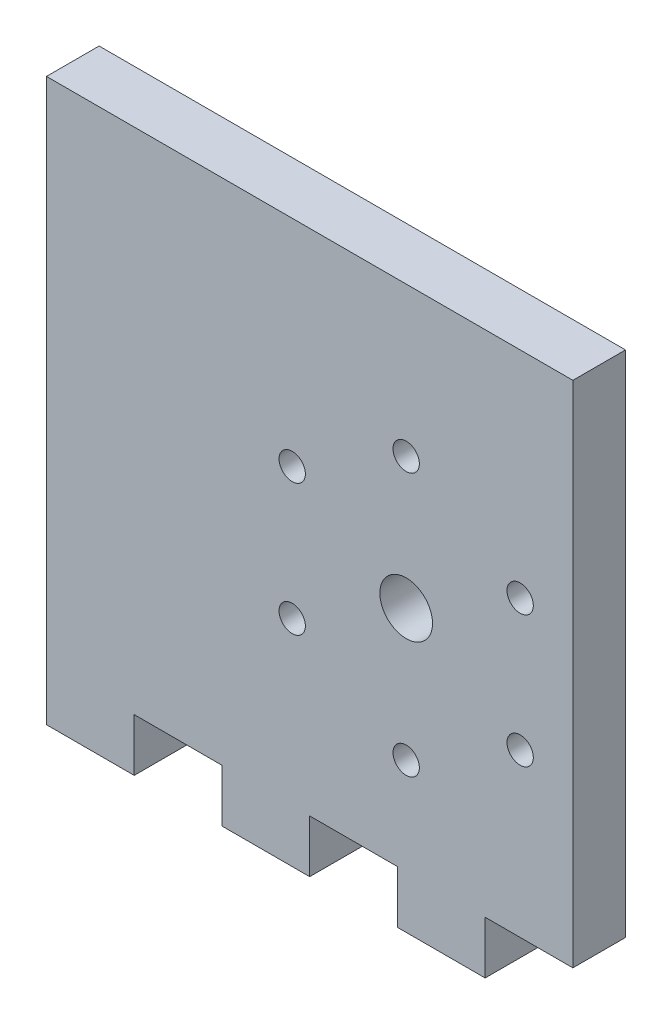
from build123d import *

# Parameters (mm, degrees)
SKETCH1_R               = 0.75
SKETCH1_R_2             = 1.5
BOSS_EXTRUDE1_DEPTH     = 3
CORTAR_EXTRUIR1_START   = -3
CROQUIS1_W              = 15
CROQUIS1_H              = 6.71890751
CORTAR_EXTRUIR1_DEPTH   = 3
CROQUIS2_W              = 30
CROQUIS2_H              = 3
SALIENTE_EXTRUIR1_DEPTH = 3


with BuildPart() as part:
    # Sketch1 → Boss-Extrude1 (new body)
    with BuildSketch(Plane.XY):
        Polygon((10, 0), (10, 3), (15, 3), (15, 0), (20, 0), (20, 3), (25, 3), (25, 0), (30, 0), (30, -26), (25, -26), (25, -29), (20, -29), (20, -26), (15, -26), (15, -29), (10, -29), (10, -26), (5, -26), (5, -29), (0, -29), (0, 0), align=None)
        with Locations((20.5, -5.5)):
            Circle(SKETCH1_R, mode=Mode.SUBTRACT)
        with Locations((26.995190528, -9.25)):
            Circle(SKETCH1_R, mode=Mode.SUBTRACT)
        with Locations((26.995190528, -16.75)):
            Circle(SKETCH1_R, mode=Mode.SUBTRACT)
        with Locations((20.5, -20.5)):
            Circle(SKETCH1_R, mode=Mode.SUBTRACT)
        with Locations((14.004809472, -16.75)):
            Circle(SKETCH1_R, mode=Mode.SUBTRACT)
        with Locations((14.004809472, -9.25)):
            Circle(SKETCH1_R, mode=Mode.SUBTRACT)
        with Locations((20.5, -13)):
            Circle(SKETCH1_R_2, mode=Mode.SUBTRACT)
    extrude(amount=BOSS_EXTRUDE1_DEPTH)

    # Croquis1 → Cortar-Extruir1 (cut)
    with BuildSketch(Plane.XY.offset(3).offset(CORTAR_EXTRUIR1_START)):
        with Locations((17.5, 3.359453755)):
            Rectangle(CROQUIS1_W, CROQUIS1_H)
    extrude(amount=CORTAR_EXTRUIR1_DEPTH, mode=Mode.SUBTRACT)

    # Croquis2 → Saliente-Extruir1 (add)
    with BuildSketch(Plane.XY.offset(3)):
        with Locations((15, 1.5)):
            Rectangle(CROQUIS2_W, CROQUIS2_H)
    extrude(amount=-SALIENTE_EXTRUIR1_DEPTH)


solid = part.part
